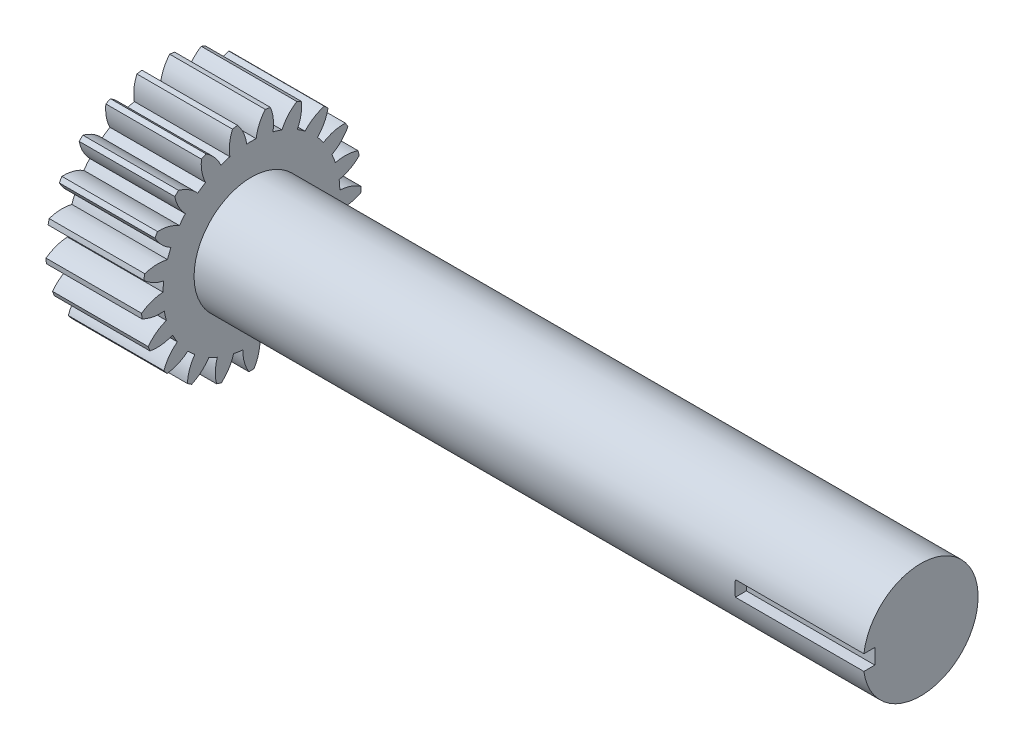
from build123d import *

# Parameters (mm, degrees)
BASPROSKE_W         = 12.5
BASPROSKE_H         = 14.375
TOOTHCUT_DEPTH      = 24.864853865
TEETHCUTS_COUNT     = 21
TEETHCUTS_ANGLE     = 342.857142857
BORSKE_R            = 4
BORE_DEPTH          = 50.0000508
SKETCH1_R           = 7.5
BOSS_EXTRUDE1_DEPTH = 100
SKETCH2_W           = 3
SKETCH2_H           = 2
CUT_EXTRUDE1_DEPTH  = 16.8


with BuildPart() as part:
    # BasProSke → Base-Revolve (revolve)
    with BuildSketch(Plane(origin=(0, 0, 0), x_dir=(1, 0, 0), z_dir=(0, 1, 0)), mode=Mode.PRIVATE) as base_revolve_sk:
        with Locations((6.25, 7.1875)):
            Rectangle(BASPROSKE_W, BASPROSKE_H)
    revolve(base_revolve_sk.sketch.rotate(Axis((-10, 0, 0), (1, 0, 0)), 180), axis=Axis((-10, 0, 0), (1, 0, 0)))

    # TooCutSke → ToothCut (cut, through all)
    with BuildSketch(Plane(origin=(0, 0, 0), x_dir=(0, 0, -1), z_dir=(1, 0, 0))):
        with BuildLine():
            ThreePointArc((0.615260942, 11.545117419), (0, 11.5615), (-0.615260942, 11.545117419))
            ThreePointArc((-0.615260942, 11.545117419), (-1.023565158, 13.002884474), (-1.830858013, 14.283538746))
            ThreePointArc((-1.830858013, 14.283538746), (0, 14.4004), (1.830858013, 14.283538746))
            ThreePointArc((1.830858013, 14.283538746), (1.023565158, 13.002884474), (0.615260942, 11.545117419))
        make_face()
    toothcut = extrude(amount=TOOTHCUT_DEPTH, mode=Mode.SUBTRACT)

    # TeethCuts: ToothCut ×21 about axis
    teethcuts_axis = Axis((-10, 0, 0), (1, 0, 0))
    for i in range(1, TEETHCUTS_COUNT):
        add(toothcut.rotate(teethcuts_axis, i * TEETHCUTS_ANGLE / (TEETHCUTS_COUNT - 1)), mode=Mode.SUBTRACT)

    # BorSke → Bore (cut, symmetric)
    with BuildSketch(Plane(origin=(0, 0, 0), x_dir=(0, 0, -1), z_dir=(1, 0, 0))):
        with Locations(Location((0, 0, 0), (0, 0, 180))):
            Circle(BORSKE_R)
    extrude(amount=BORE_DEPTH, both=True, mode=Mode.SUBTRACT)

    # Sketch1 → Boss-Extrude1 (add)
    with BuildSketch(Plane.ZY):
        Circle(SKETCH1_R)
    extrude(amount=-BOSS_EXTRUDE1_DEPTH)

    # Sketch2 → Cut-Extrude1 (cut)
    with BuildSketch(Plane(origin=(100, 0, 0), x_dir=(0, 0, -1), z_dir=(1, 0, 0))):
        with Locations((-7.5, 0)):
            Rectangle(SKETCH2_W, SKETCH2_H)
    extrude(amount=-CUT_EXTRUDE1_DEPTH, mode=Mode.SUBTRACT)


solid = part.part
